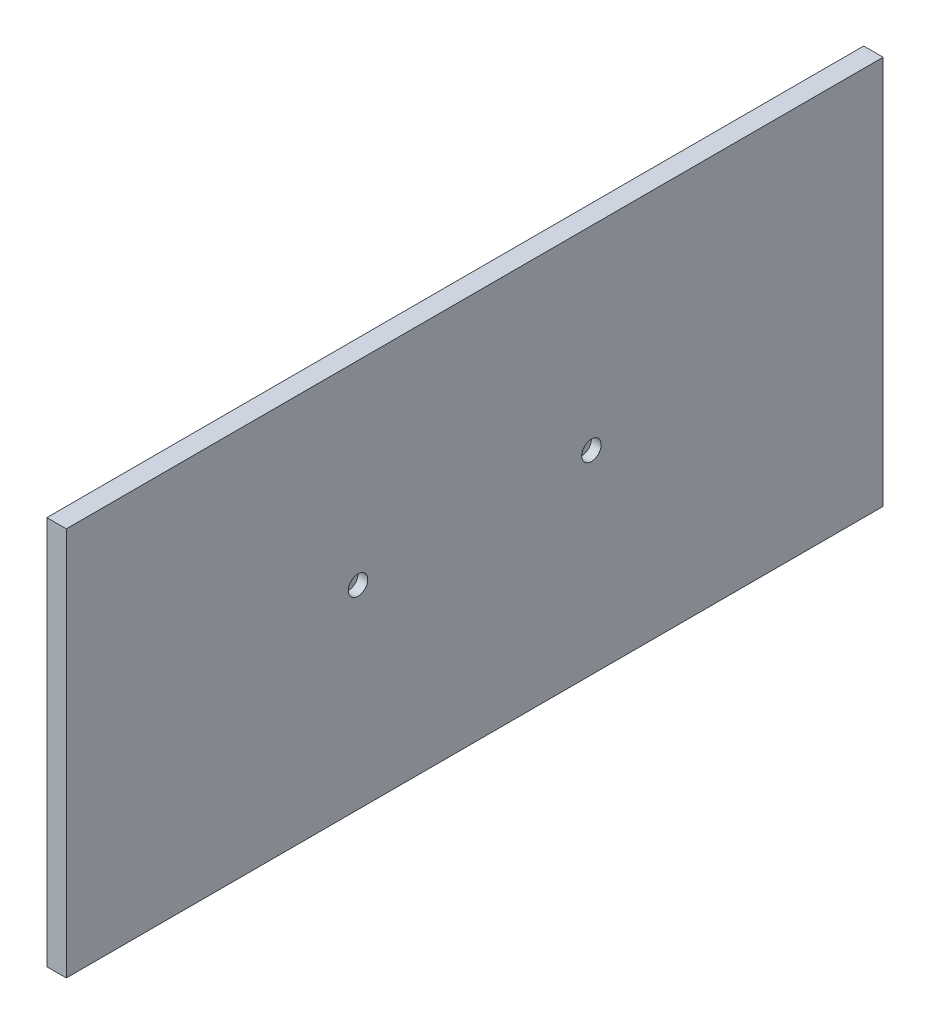
from build123d import *

# Parameters (mm, degrees)
SKETCH_1_W          = 420
SKETCH_1_H          = 200
EXTRUDE_1_DEPTH     = 10
SKETCH_2_R          = 5
CUT_EXTRUDE_1_DEPTH = 5


with BuildPart() as part:
    # Эскиз1 → Бобышка-Вытянуть1 (new body)
    with BuildSketch(Plane(origin=(0, 0, 0), x_dir=(0, 0, -1), z_dir=(1, 0, 0))):
        with Locations((210, 100)):
            Rectangle(SKETCH_1_W, SKETCH_1_H)
    extrude(amount=EXTRUDE_1_DEPTH)

    # Эскиз2 → Вырез-Вытянуть1 (cut)
    with BuildSketch(Plane(origin=(10, 0, 0), x_dir=(0, 0, -1), z_dir=(1, 0, 0))):
        with Locations((150, 100)):
            Circle(SKETCH_2_R)
        with Locations((270, 100)):
            Circle(SKETCH_2_R)
    extrude(amount=-CUT_EXTRUDE_1_DEPTH, mode=Mode.SUBTRACT)


solid = part.part
